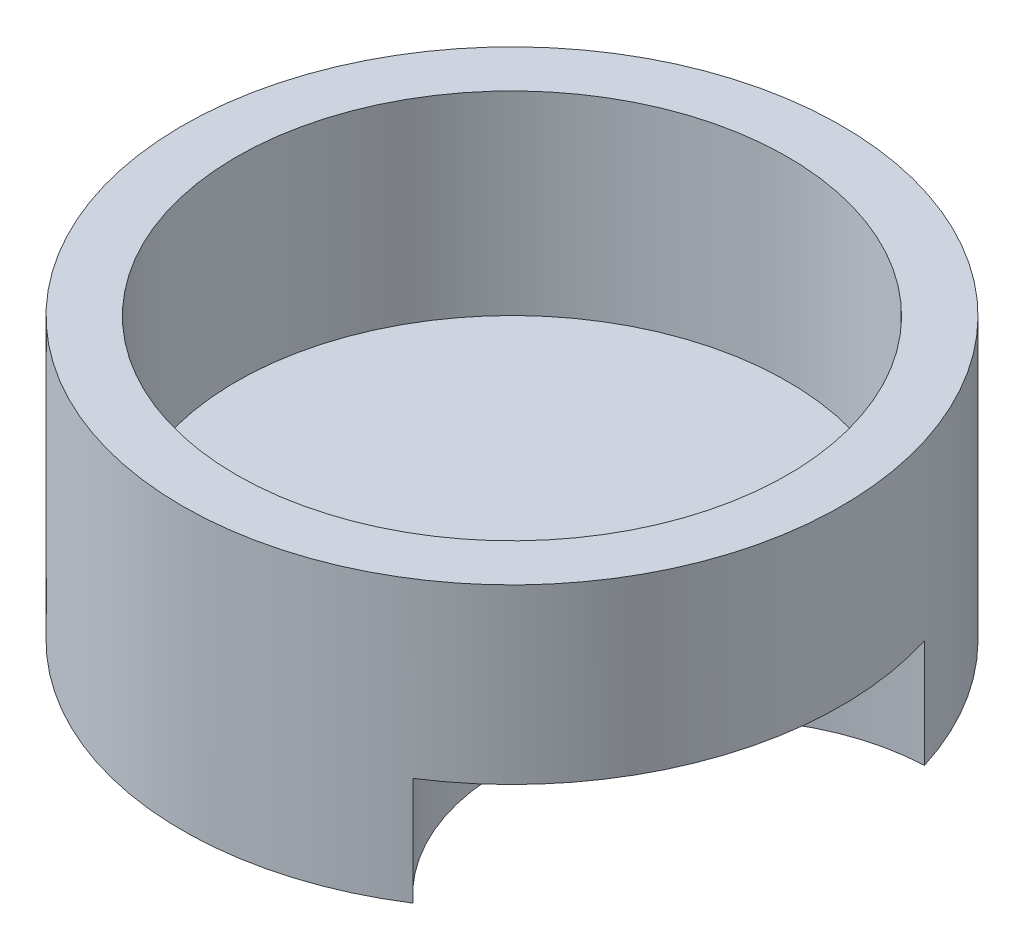
from build123d import *

# Parameters (mm, degrees)
SKETCH_1_R          = 3.05
SKETCH_1_R_2        = 2.55
EXTRUDE_1_DEPTH     = 1.8
EXTRUDE_START       = 0.8
SKETCH_2_R          = 3.05
EXTRUDE_2_DEPTH     = 0.8
SKETCH_3_R          = 2
CUT_EXTRUDE_1_DEPTH = 1


with BuildPart() as part:
    # 草图1 → 凸台-拉伸1 (new body)
    with BuildSketch(Plane(origin=(0, 0, 0), x_dir=(1, 0, 0), z_dir=(0, 1, 0))):
        with Locations(Location((0, 0, 0), (0, 0, 270))):
            Circle(SKETCH_1_R)
        with Locations(Location((0, 0, 0), (0, 0, 270))):
            Circle(SKETCH_1_R_2, mode=Mode.SUBTRACT)
    extrude(amount=EXTRUDE_1_DEPTH)

    # 草图2 → 凸台-拉伸2 (add)
    with BuildSketch(Plane.XZ.offset(EXTRUDE_START)):
        with Locations(Location((0, 0, 0), (0, 0, 270))):
            Circle(SKETCH_2_R)
    extrude(amount=-EXTRUDE_2_DEPTH)

    # 草图3 → 切除-拉伸1 (cut)
    with BuildSketch(Plane.XZ.offset(0.8)):
        with Locations((3, 1.092527685)):
            Circle(SKETCH_3_R)
    extrude(amount=-CUT_EXTRUDE_1_DEPTH, mode=Mode.SUBTRACT)


solid = part.part
